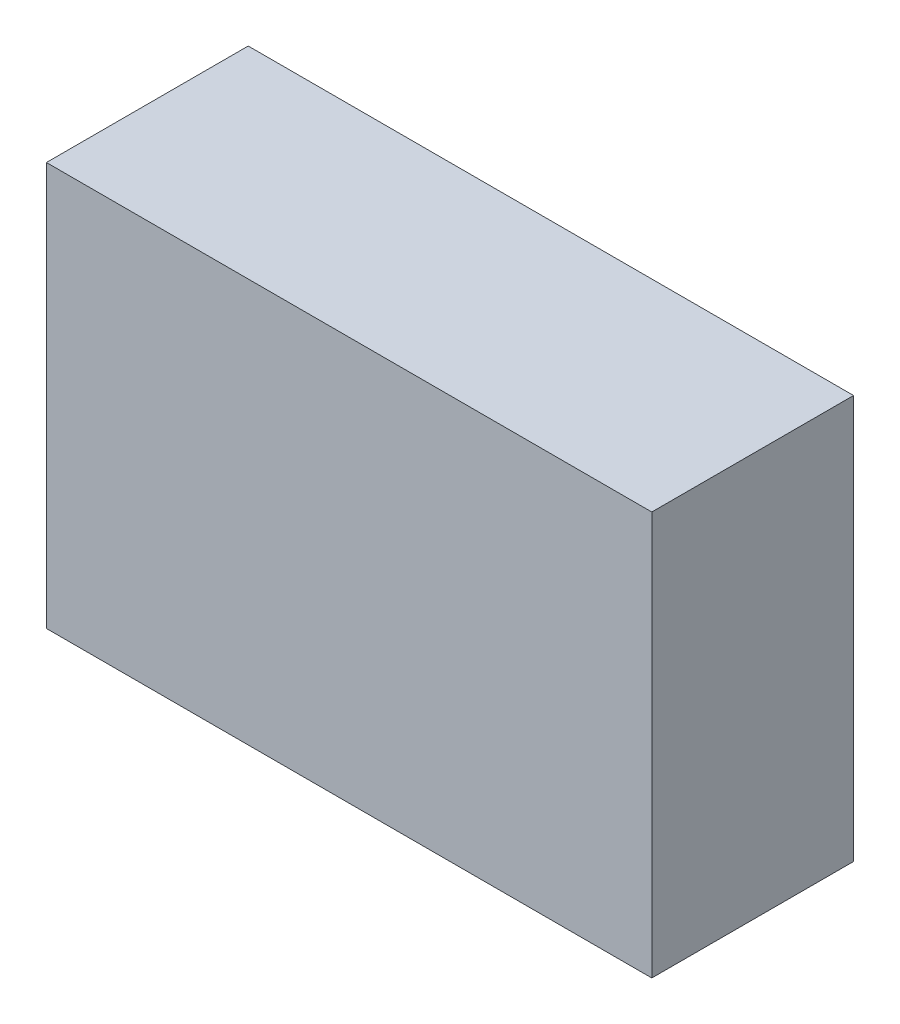
from build123d import *

# Parameters (mm, degrees)
SKETCH1_W           = 15
SKETCH1_H           = 10
BOSS_EXTRUDE1_DEPTH = 5


with BuildPart() as part:
    # Sketch1 → Boss-Extrude1 (new body)
    with BuildSketch(Plane.XY):
        Rectangle(SKETCH1_W, SKETCH1_H)
    extrude(amount=-BOSS_EXTRUDE1_DEPTH)


solid = part.part
